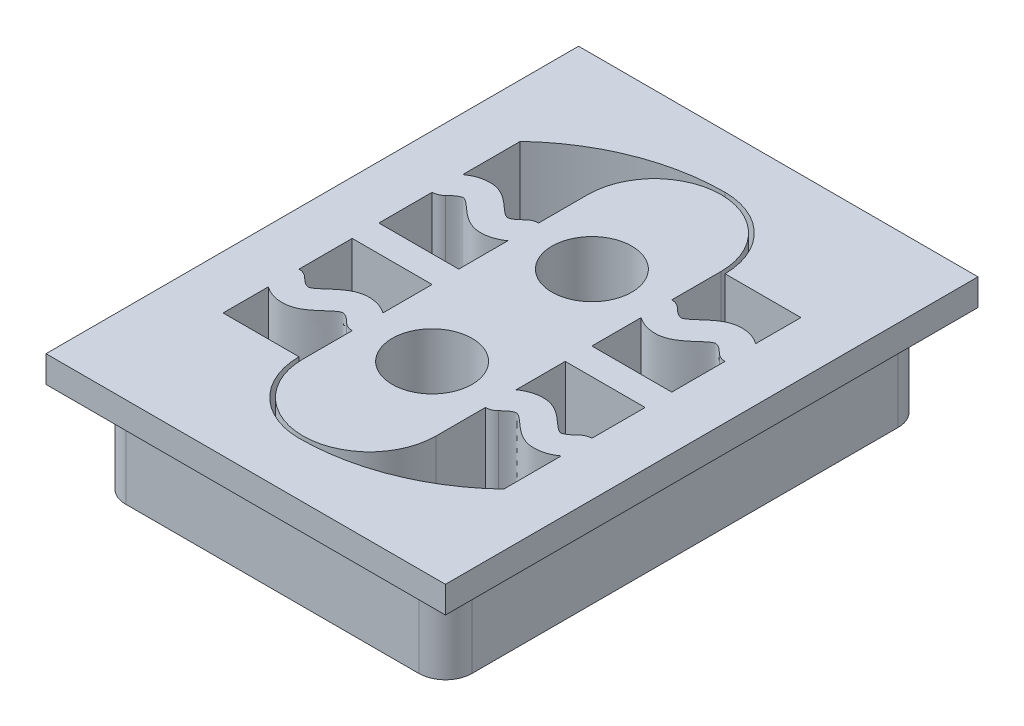
from build123d import *

# Parameters (mm, degrees)
SKETCH1_W           = 13
SKETCH1_H           = 18
BOSS_EXTRUDE1_DEPTH = 3.4
SKETCH2_W           = 15
SKETCH2_H           = 20
BOSS_EXTRUDE2_DEPTH = 1
SKETCH4_R           = 1.5
CUT_EXTRUDE2_DEPTH  = 10
FILLET1_R           = 1


with BuildPart() as part:
    # Sketch1 → Boss-Extrude1 (new body)
    with BuildSketch(Plane(origin=(0, 0, 0), x_dir=(1, 0, 0), z_dir=(0, 1, 0))):
        Rectangle(SKETCH1_W, SKETCH1_H)
    extrude(amount=BOSS_EXTRUDE1_DEPTH)

    # Sketch2 → Boss-Extrude2 (add)
    with BuildSketch(Plane(origin=(0, 3.4, 0), x_dir=(1, 0, 0), z_dir=(0, 1, 0))):
        Rectangle(SKETCH2_W, SKETCH2_H)
    extrude(amount=BOSS_EXTRUDE2_DEPTH)

    # Sketch4 → Cut-Extrude2 (cut)
    with BuildSketch(Plane.XZ):
        with Locations(Location((0, 3, 0), (0, 0, 270))):
            Circle(SKETCH4_R)
        with Locations(Location((0, -3, 0), (0, 0, 270))):
            Circle(SKETCH4_R)
        with BuildLine():
            ThreePointArc((0, 8), (-1.87383297, 7.22383297), (-2.65, 5.35))
            Line((-2.65, 5.35), (-5.5, 5.35))
            Line((-5.5, 5.35), (-5.5, 3.651406842))
            add(Edge.make_bspline(
                [(-5.5, 3.651406842), (-5.406598186, 3.716096448), (-5.101794731, 3.887751724), (-4.503330165, 3.949879095), (-3.984278911, 3.661658876), (-3.655115116, 3.35997064), (-3.393346141, 3.1328127), (-3.28033535, 3.09163995), (-3.247918098, 3.090303884), (-3.18406338, 3.104314594), (-3.06117869, 3.166784448), (-2.912518243, 3.294949286), (-2.852476749, 3.354626764)],
                knots=[0.070231934, 0.070231934, 0.070231934, 0.070231934, 0.125, 0.25, 0.375, 0.5, 0.625, 0.75, 0.8125, 0.875, 0.9375, 1, 1, 1, 1], degree=3))
            ThreePointArc((-2.852476749, 3.354626764), (-2.690639212, 3.462230128), (-2.5, 3.5))
            Line((-2.5, 3.5), (-2.5, 5.35))
            ThreePointArc((-2.5, 5.35), (0, 7.85), (2.5, 5.35))
            Line((2.5, 5.35), (2.5, 3.5))
            ThreePointArc((2.5, 3.5), (2.690639212, 3.462230128), (2.852476749, 3.354626764))
            add(Edge.make_bspline(
                [(5.5, 3.651406842), (5.406598186, 3.716096448), (5.101794731, 3.887751724), (4.503330165, 3.949879095), (3.984278911, 3.661658876), (3.655115116, 3.35997064), (3.393346141, 3.1328127), (3.28033535, 3.09163995), (3.247918098, 3.090303884), (3.18406338, 3.104314594), (3.06117869, 3.166784448), (2.912518243, 3.294949286), (2.852476749, 3.354626764)],
                knots=[0.070231934, 0.070231934, 0.070231934, 0.070231934, 0.125, 0.25, 0.375, 0.5, 0.625, 0.75, 0.8125, 0.875, 0.9375, 1, 1, 1, 1], degree=3))
            Line((5.5, 3.651406842), (5.5, 5.809475019))
            ThreePointArc((5.5, 5.809475019), (2.960084445, 7.4322204), (0, 8))
        make_face()
        with BuildLine():
            ThreePointArc((-5.147523251, 2.645373236), (-5.309360788, 2.537769872), (-5.5, 2.5))
            Line((-5.5, 2.5), (-5.5, 0.5))
            Line((-5.5, 0.5), (-2.5, 0.5))
            Line((-2.5, 0.5), (-2.5, 2.348593158))
            add(Edge.make_bspline(
                [(-5.147523251, 2.645373236), (-5.087481757, 2.705050714), (-4.93882131, 2.833215552), (-4.81593662, 2.895685406), (-4.752081902, 2.909696116), (-4.71966465, 2.90836005), (-4.606653859, 2.8671873), (-4.344884884, 2.64002936), (-4.015721089, 2.338341124), (-3.496669835, 2.050120905), (-2.898205269, 2.112248276), (-2.593401814, 2.283903552), (-2.5, 2.348593158)],
                knots=[0, 0, 0, 0, 0.0625, 0.125, 0.1875, 0.25, 0.375, 0.5, 0.625, 0.75, 0.875, 0.929768066, 0.929768066, 0.929768066, 0.929768066], degree=3))
        make_face()
        with BuildLine():
            Line((5.5, 0.5), (5.5, 2.5))
            ThreePointArc((5.5, 2.5), (5.309360788, 2.537769872), (5.147523251, 2.645373236))
            add(Edge.make_bspline(
                [(5.147523251, 2.645373236), (5.087481757, 2.705050714), (4.93882131, 2.833215552), (4.81593662, 2.895685406), (4.752081902, 2.909696116), (4.71966465, 2.90836005), (4.606653859, 2.8671873), (4.344884884, 2.64002936), (4.015721089, 2.338341124), (3.496669835, 2.050120905), (2.898205269, 2.112248276), (2.593401814, 2.283903552), (2.5, 2.348593158)],
                knots=[0, 0, 0, 0, 0.0625, 0.125, 0.1875, 0.25, 0.375, 0.5, 0.625, 0.75, 0.875, 0.929768066, 0.929768066, 0.929768066, 0.929768066], degree=3))
            Line((2.5, 2.348593158), (2.5, 0.5))
            Line((2.5, 0.5), (5.5, 0.5))
        make_face()
        with BuildLine():
            Line((-2.5, -0.5), (-5.5, -0.5))
            Line((-5.5, -0.5), (-5.5, -2.5))
            ThreePointArc((-5.5, -2.5), (-5.309360788, -2.537769872), (-5.147523251, -2.645373236))
            add(Edge.make_bspline(
                [(-5.147523251, -2.645373236), (-5.087481757, -2.705050714), (-4.93882131, -2.833215552), (-4.81593662, -2.895685406), (-4.752081902, -2.909696116), (-4.71966465, -2.90836005), (-4.606653859, -2.8671873), (-4.344884884, -2.64002936), (-4.015721089, -2.338341124), (-3.496669835, -2.050120905), (-2.898205269, -2.112248276), (-2.593401814, -2.283903552), (-2.5, -2.348593158)],
                knots=[0, 0, 0, 0, 0.0625, 0.125, 0.1875, 0.25, 0.375, 0.5, 0.625, 0.75, 0.875, 0.929768066, 0.929768066, 0.929768066, 0.929768066], degree=3))
            Line((-2.5, -2.348593158), (-2.5, -0.5))
        make_face()
        with BuildLine():
            Line((5.5, -2.5), (5.5, -0.5))
            Line((5.5, -0.5), (2.5, -0.5))
            Line((2.5, -0.5), (2.5, -2.348593158))
            add(Edge.make_bspline(
                [(5.147523251, -2.645373236), (5.087481757, -2.705050714), (4.93882131, -2.833215552), (4.81593662, -2.895685406), (4.752081902, -2.909696116), (4.71966465, -2.90836005), (4.606653859, -2.8671873), (4.344884884, -2.64002936), (4.015721089, -2.338341124), (3.496669835, -2.050120905), (2.898205269, -2.112248276), (2.593401814, -2.283903552), (2.5, -2.348593158)],
                knots=[0, 0, 0, 0, 0.0625, 0.125, 0.1875, 0.25, 0.375, 0.5, 0.625, 0.75, 0.875, 0.929768066, 0.929768066, 0.929768066, 0.929768066], degree=3))
            ThreePointArc((5.147523251, -2.645373236), (5.309360788, -2.537769872), (5.5, -2.5))
        make_face()
        with BuildLine():
            add(Edge.make_bspline(
                [(-5.5, -3.651406842), (-5.406598186, -3.716096448), (-5.101794731, -3.887751724), (-4.503330165, -3.949879095), (-3.984278911, -3.661658876), (-3.655115116, -3.35997064), (-3.393346141, -3.1328127), (-3.28033535, -3.09163995), (-3.247918098, -3.090303884), (-3.18406338, -3.104314594), (-3.06117869, -3.166784448), (-2.912518243, -3.294949286), (-2.852476749, -3.354626764)],
                knots=[0.070231934, 0.070231934, 0.070231934, 0.070231934, 0.125, 0.25, 0.375, 0.5, 0.625, 0.75, 0.8125, 0.875, 0.9375, 1, 1, 1, 1], degree=3))
            Line((-5.5, -3.651406842), (-5.5, -5.809475019))
            ThreePointArc((-5.5, -5.809475019), (-2.960084445, -7.4322204), (0, -8))
            ThreePointArc((0, -8), (1.87383297, -7.22383297), (2.65, -5.35))
            Line((2.65, -5.35), (5.5, -5.35))
            Line((5.5, -5.35), (5.5, -3.651406842))
            add(Edge.make_bspline(
                [(5.5, -3.651406842), (5.406598186, -3.716096448), (5.101794731, -3.887751724), (4.503330165, -3.949879095), (3.984278911, -3.661658876), (3.655115116, -3.35997064), (3.393346141, -3.1328127), (3.28033535, -3.09163995), (3.247918098, -3.090303884), (3.18406338, -3.104314594), (3.06117869, -3.166784448), (2.912518243, -3.294949286), (2.852476749, -3.354626764)],
                knots=[0.070231934, 0.070231934, 0.070231934, 0.070231934, 0.125, 0.25, 0.375, 0.5, 0.625, 0.75, 0.8125, 0.875, 0.9375, 1, 1, 1, 1], degree=3))
            ThreePointArc((2.852476749, -3.354626764), (2.690639212, -3.462230128), (2.5, -3.5))
            Line((2.5, -3.5), (2.5, -5.35))
            ThreePointArc((2.5, -5.35), (0, -7.85), (-2.5, -5.35))
            Line((-2.5, -5.35), (-2.5, -3.5))
            ThreePointArc((-2.5, -3.5), (-2.690639212, -3.462230128), (-2.852476749, -3.354626764))
        make_face()
    extrude(amount=-CUT_EXTRUDE2_DEPTH, mode=Mode.SUBTRACT)

    # Fillet1
    fillet1_edges = [part.edges().sort_by_distance(p)[0] for p in [
        (6.5, 1.7, 9),
        (-6.5, 1.7, 9),
        (-6.5, 1.7, -9),
        (6.5, 1.7, -9),
    ]]
    fillet(fillet1_edges, radius=FILLET1_R)


solid = part.part
